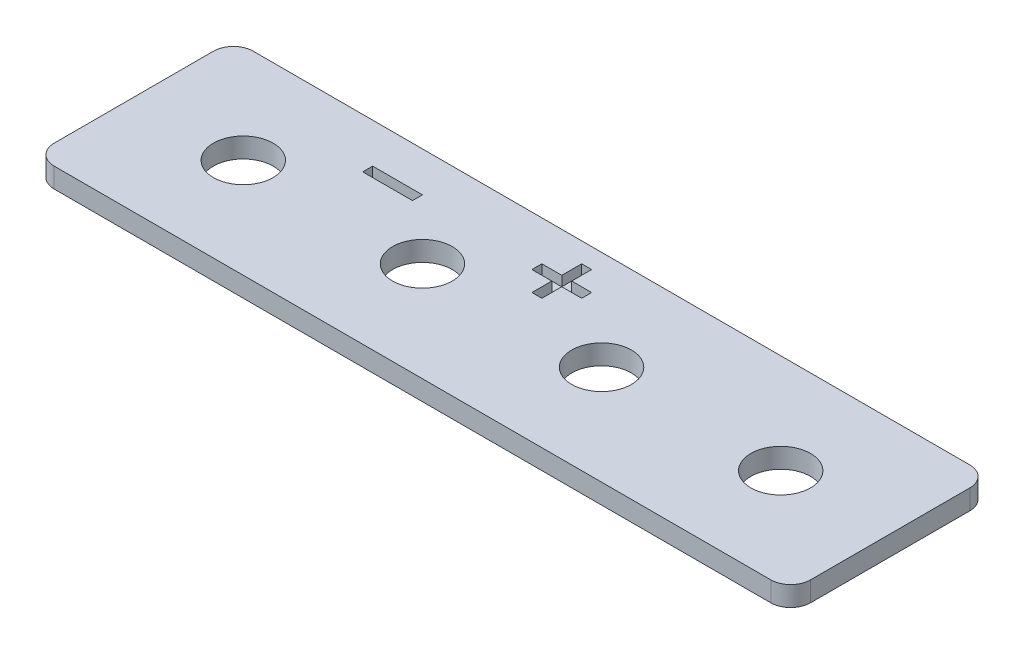
from build123d import *

# Parameters (mm, degrees)
SKETCH_1_W          = 38
SKETCH_1_H          = 10
EXTRUDE_1_DEPTH     = 1
FILLET_1_R          = 1
SKETCH_2_R          = 1.5
CUT_EXTRUDE_1_DEPTH = 20.672315573
SKETCH_3_W          = 2.5
SKETCH_3_H          = 0.5
CUT_EXTRUDE_2_DEPTH = 0.5


with BuildPart() as part:
    # Эскиз1 → Бобышка-Вытянуть1 (new body)
    with BuildSketch(Plane(origin=(0, 0, 0), x_dir=(1, 0, 0), z_dir=(0, 1, 0))):
        Rectangle(SKETCH_1_W, SKETCH_1_H)
    extrude(amount=EXTRUDE_1_DEPTH)

    # Скругление1
    fillet_1_edges = [part.edges().sort_by_distance(p)[0] for p in [
        (19, 0.5, 5),
        (-19, 0.5, 5),
        (-19, 0.5, -5),
        (19, 0.5, -5),
    ]]
    fillet(fillet_1_edges, radius=FILLET_1_R)

    # Эскиз2 → Вырез-Вытянуть1 (cut, through all)
    with BuildSketch(Plane(origin=(0, 1, 0), x_dir=(1, 0, 0), z_dir=(0, 1, 0))):
        with Locations(Location((-13.5, 0, 0), (0, 0, 270))):
            Circle(SKETCH_2_R)
        with Locations(Location((-4.5, 0, 0), (0, 0, 270))):
            Circle(SKETCH_2_R)
        with Locations(Location((4.5, 0, 0), (0, 0, 270))):
            Circle(SKETCH_2_R)
        with Locations(Location((13.5, 0, 0), (0, 0, 270))):
            Circle(SKETCH_2_R)
    extrude(amount=-CUT_EXTRUDE_1_DEPTH, mode=Mode.SUBTRACT)

    # Эскиз3 → Вырез-Вытянуть2 (cut)
    with BuildSketch(Plane(origin=(0, 1, 0), x_dir=(1, 0, 0), z_dir=(0, 1, 0))):
        Polygon((0, 2.5), (0, 1.5), (-0.5, 1.5), (-0.5, 2.5), (-1.5, 2.5), (-1.5, 3), (-0.5, 3), (-0.5, 4), (0, 4), (0, 3), (1, 3), (1, 2.5), align=None)
        with Locations((-8.75, 2.75)):
            Rectangle(SKETCH_3_W, SKETCH_3_H)
    extrude(amount=-CUT_EXTRUDE_2_DEPTH, mode=Mode.SUBTRACT)


solid = part.part
